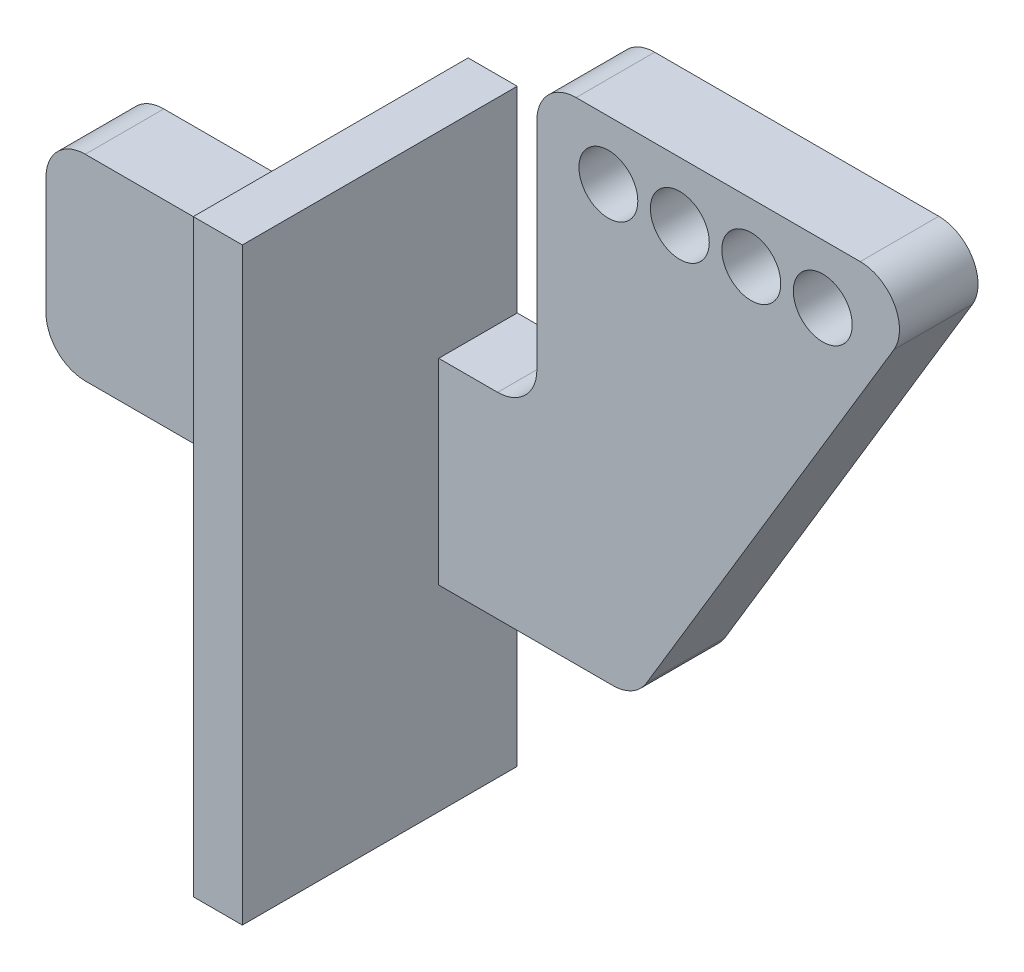
from build123d import *

# Parameters (mm, degrees)
ESQUISSE1_R        = 1.5
BOSS_EXTRU_1_DEPTH = 4
ESQUISSE2_W        = 2.5
ESQUISSE2_H        = 30
BOSS_EXTRU_2_DEPTH = 10
CONG_1_R           = 2


with BuildPart() as part:
    # Esquisse1 → Boss.-Extru.1 (new body)
    with BuildSketch(Plane.XY):
        Polygon((0, 0), (0, 15), (20, 15), (5, -10), (-5, -10), (-5, -20), (-7.5, -20), (-7.5, -10), (-25, -10), (-25, 0), (-7.5, 0), (-7.5, 10), (-5, 10), (-5, 0), align=None)
        with Locations((3.64, 12)):
            Circle(ESQUISSE1_R, mode=Mode.SUBTRACT)
        with Locations((7.28, 12)):
            Circle(ESQUISSE1_R, mode=Mode.SUBTRACT)
        with Locations((10.92, 12)):
            Circle(ESQUISSE1_R, mode=Mode.SUBTRACT)
        with Locations((14.56, 12)):
            Circle(ESQUISSE1_R, mode=Mode.SUBTRACT)
    extrude(amount=BOSS_EXTRU_1_DEPTH)

    # Esquisse2 → Boss.-Extru.2 (add)
    with BuildSketch(Plane.XY.offset(4)):
        with Locations((-6.25, -5)):
            Rectangle(ESQUISSE2_W, ESQUISSE2_H)
    extrude(amount=BOSS_EXTRU_2_DEPTH)

    # Congé1
    cong_1_edges = [part.edges().sort_by_distance(p)[0] for p in [
        (0, 0, 2),
        (0, 15, 2),
        (20, 15, 2),
        (5, -10, 2),
        (-25, -10, 2),
        (-25, 0, 2),
    ]]
    fillet(cong_1_edges, radius=CONG_1_R)


solid = part.part
